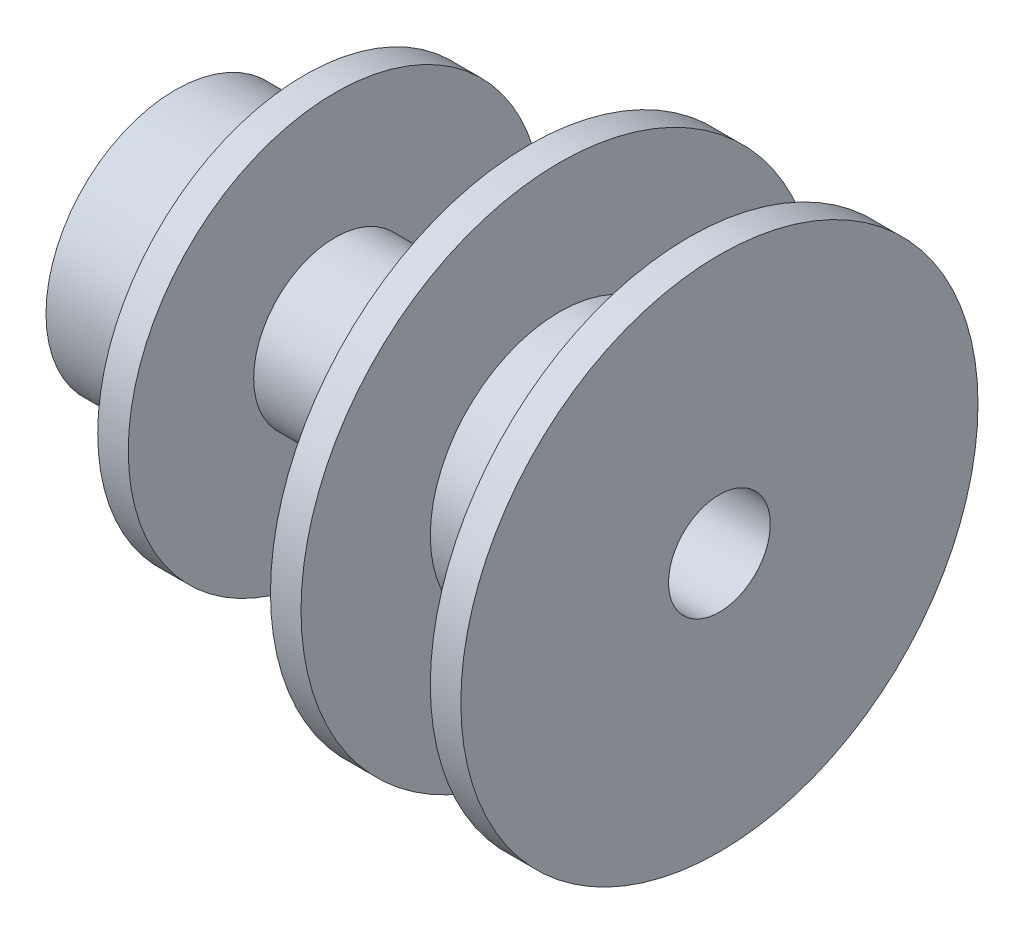
from build123d import *


with BuildPart() as part:
    # Sketch1 → Revolve1 (revolve)
    with BuildSketch(Plane.XY, mode=Mode.PRIVATE) as revolve1_sk:
        Polygon((-50.45, 12.7), (-37.75, 12.7), (-37.75, 20.32), (-34.75, 20.32), (-34.75, 8), (-15.7, 8), (-15.7, 25.4), (-12.7, 25.4), (-12.7, 12.7), (0, 12.7), (0, 25.4), (3, 25.4), (3, 5), (-50.45, 5), align=None)
    revolve(revolve1_sk.sketch.rotate(Axis((-93.571428571, 0, 0), (1, 0, 0)), 90), axis=Axis((-93.571428571, 0, 0), (1, 0, 0)))


solid = part.part
